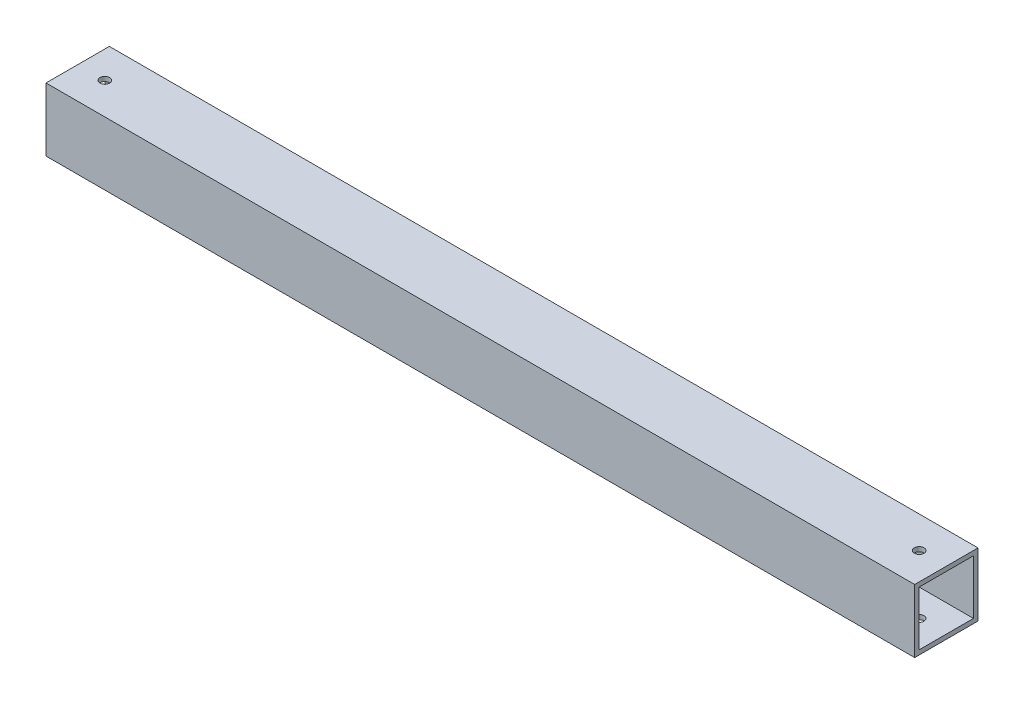
from build123d import *

# Parameters (mm, degrees)
SKETCH1_W               = 44.45
SKETCH1_H               = 44.45
SKETCH1_W_2             = 38.1
SKETCH1_H_2             = 38.1
BOSS_EXTRUDE1_DEPTH     = 609.6
F_1_4_CLEARANCE_HOLE1_D = 6.7564


with BuildPart() as part:
    # Sketch1 → Boss-Extrude1 (new body)
    with BuildSketch(Plane(origin=(0, 0, 0), x_dir=(0, 0, -1), z_dir=(1, 0, 0))):
        Rectangle(SKETCH1_W, SKETCH1_H)
        Rectangle(SKETCH1_W_2, SKETCH1_H_2, mode=Mode.SUBTRACT)
    extrude(amount=BOSS_EXTRUDE1_DEPTH)

    # 1/4 Clearance Hole1 (through all)
    with Locations(Plane(origin=(0, 22.225, 0), x_dir=(1, 0, 0), z_dir=(0, 1, 0))):
        with Locations((19.05, 0), (590.55, 0)):
            Hole(F_1_4_CLEARANCE_HOLE1_D / 2)


solid = part.part
